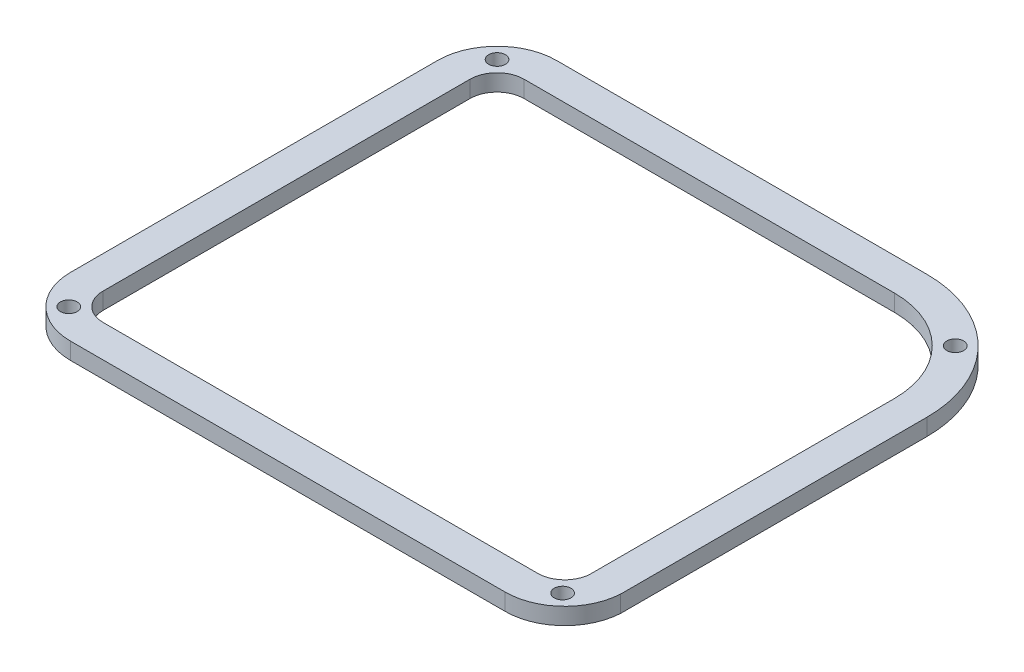
from build123d import *

# Parameters (mm, degrees)
SKETCH1_R           = 1.549999996
SKETCH1_R_2         = 1.549999999
SKETCH1_R_3         = 1.550000006
SKETCH1_R_4         = 1.55
BOSS_EXTRUDE1_DEPTH = 3.1


with BuildPart() as part:
    # Sketch1 → Boss-Extrude1 (new body)
    with BuildSketch(Plane(origin=(0, 0, 0), x_dir=(1, 0, 0), z_dir=(0, 1, 0))):
        with BuildLine():
            Line((-39.710740333, 45.601389456), (28.739259425, 45.601389477))
            ThreePointArc((28.739259425, 45.601389477), (44.917862489, 38.899992874), (51.619259444, 22.721389957))
            Line((51.619259444, 22.721389957), (51.619259444, -33.910608927))
            ThreePointArc((51.619259444, -33.910608927), (48.176648434, -41.250850634), (40.639804947, -44.238610519))
            Line((40.639804947, -44.238610519), (-39.710740094, -44.238610544))
            ThreePointArc((-39.710740094, -44.238610544), (-47.488914725, -41.01678516), (-50.710740163, -33.23861055))
            Line((-50.710740163, -33.23861055), (-50.710740163, 34.601389583))
            ThreePointArc((-50.710740163, 34.601389583), (-47.488914793, 42.379564056), (-39.710740333, 45.601389456))
        make_face()
        with Locations(Location((-45.367594445, 40.258243716, 0), (0, 0, 90))):
            Circle(SKETCH1_R, mode=Mode.SUBTRACT)
        with Locations(Location((-45.367594389, -38.895464809, 0), (0, 0, 90))):
            Circle(SKETCH1_R_2, mode=Mode.SUBTRACT)
        with Locations(Location((46.094048666, -39.090808696, 0), (0, 0, 90))):
            Circle(SKETCH1_R_3, mode=Mode.SUBTRACT)
        with Locations(Location((42.796542168, 36.778672508, 0), (0, 0, 90))):
            Circle(SKETCH1_R_4, mode=Mode.SUBTRACT)
        with BuildLine():
            Line((-39.710740331, 39.601389456), (28.739259427, 39.601389477))
            ThreePointArc((28.739259427, 39.601389477), (40.675221825, 34.657352163), (45.619259444, 22.721389891))
            Line((45.619259444, 22.721389891), (45.619259444, -33.691417556))
            ThreePointArc((45.619259444, -33.691417556), (44.011448898, -36.930766758), (40.639804981, -38.238610519))
            Line((40.639804981, -38.238610519), (-39.710740095, -38.238610544))
            ThreePointArc((-39.710740095, -38.238610544), (-43.246274043, -36.774144468), (-44.710740163, -33.238610539))
            Line((-44.710740163, -33.238610539), (-44.710740163, 34.601389583))
            ThreePointArc((-44.710740163, 34.601389583), (-43.246274105, 38.136923369), (-39.710740331, 39.601389456))
        make_face(mode=Mode.SUBTRACT)
    extrude(amount=BOSS_EXTRUDE1_DEPTH)


solid = part.part
